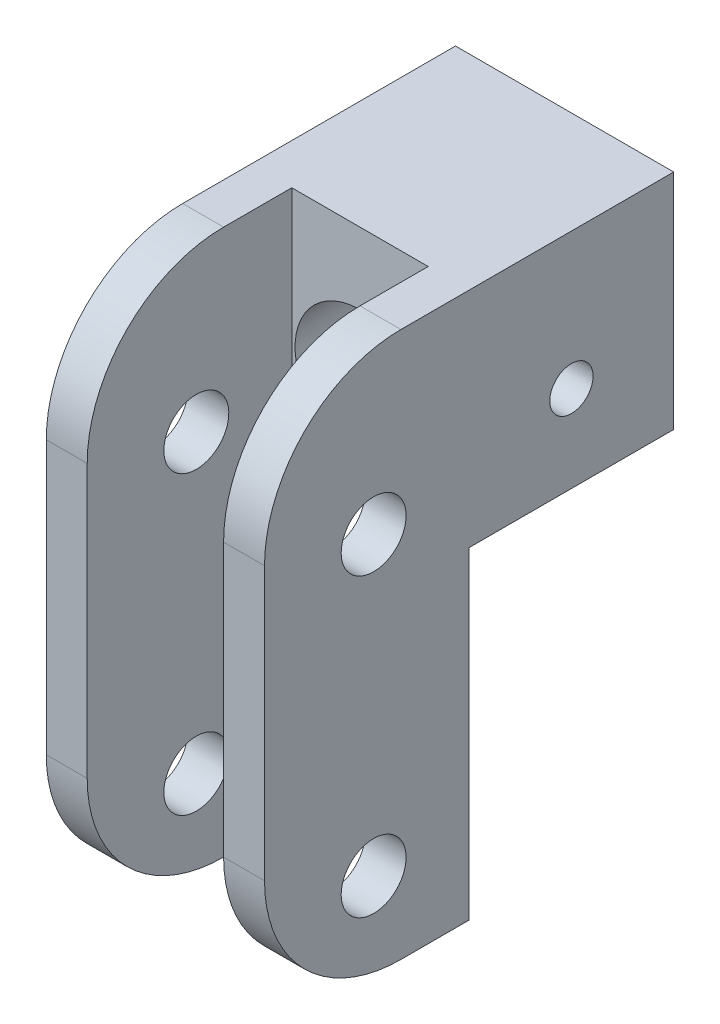
from build123d import *

# Parameters (mm, degrees)
SKETCH1_W                      = 16
SKETCH1_H                      = 40
BOSS_EXTRUDE1_DEPTH            = 30
F_3_8_0_3750_DOWEL_HOLE1_D     = 9.525
F_1_8_0_1250_DOWEL_HOLE1_D     = 3.175
SKETCH7_W                      = 10
SKETCH7_H                      = 40
CUT_EXTRUDE1_DEPTH             = 15
F_3_16_0_1875_DIAMETER_HOLE1_D = 4.7625
SKETCH10_W                     = 16
SKETCH10_H                     = 23.65
CUT_EXTRUDE2_DEPTH             = 15
FILLET1_R                      = 10


with BuildPart() as part:
    # Sketch1 → Boss-Extrude1 (new body)
    with BuildSketch(Plane.XY):
        with Locations((0, -10)):
            Rectangle(SKETCH1_W, SKETCH1_H)
    extrude(amount=BOSS_EXTRUDE1_DEPTH)

    # 3/8 (0.3750) Dowel Hole1 (through all)
    with Locations(Plane.XY.offset(30)):
        with Locations((0, 0)):
            Hole(F_3_8_0_3750_DOWEL_HOLE1_D / 2)

    # 1/8 (0.1250) Dowel Hole1 (through all)
    with Locations(Plane.ZY.offset(8)):
        with Locations((7.5, 0)):
            Hole(F_1_8_0_1250_DOWEL_HOLE1_D / 2)

    # Sketch7 → Cut-Extrude1 (cut)
    with BuildSketch(Plane.XY.offset(30)):
        with Locations((0, -10)):
            Rectangle(SKETCH7_W, SKETCH7_H)
    extrude(amount=-CUT_EXTRUDE1_DEPTH, mode=Mode.SUBTRACT)

    # 3/16 (0.1875) Diameter Hole1 (through all)
    with Locations(Plane.ZY.offset(8)):
        with Locations((22, -2), (22, -23.7)):
            Hole(F_3_16_0_1875_DIAMETER_HOLE1_D / 2)

    # Sketch10 → Cut-Extrude2 (cut)
    with BuildSketch(Plane(origin=(0, 0, 0), x_dir=(-1, 0, 0), z_dir=(0, 0, -1))):
        with Locations((0, -18.175)):
            Rectangle(SKETCH10_W, SKETCH10_H)
    extrude(amount=-CUT_EXTRUDE2_DEPTH, mode=Mode.SUBTRACT)

    # Fillet1
    fillet1_edges = [part.edges().sort_by_distance(p)[0] for p in [
        (6.5, 10, 30),
        (6.5, -30, 30),
        (-6.5, 10, 30),
        (-6.5, -30, 30),
    ]]
    fillet(fillet1_edges, radius=FILLET1_R)


solid = part.part
